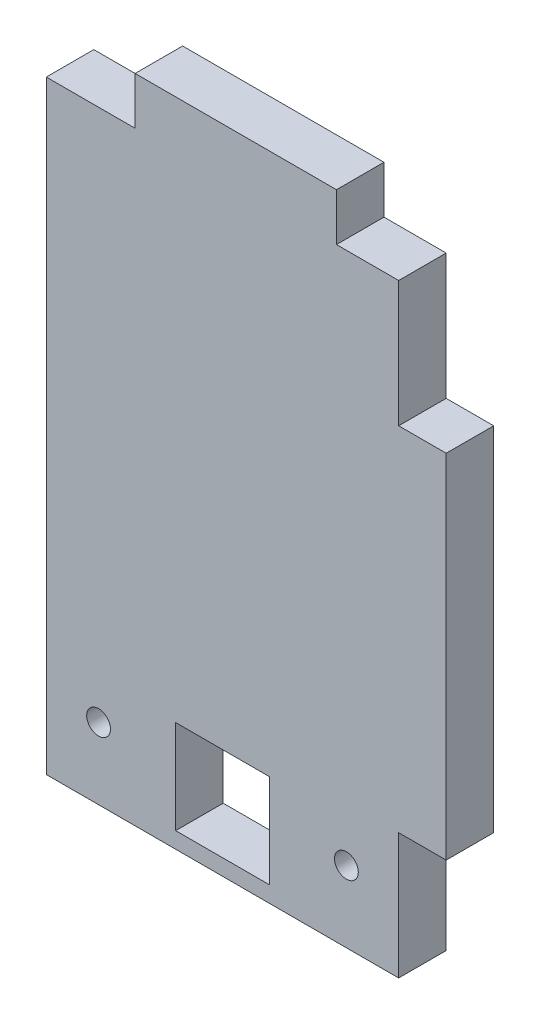
from build123d import *

# Parameters (mm, degrees)
SKETCH1_R           = 1.5
SKETCH1_W           = 11.811
SKETCH1_H           = 11.811
BOSS_EXTRUDE1_DEPTH = 5.9944


with BuildPart() as part:
    # Sketch1 → Boss-Extrude1 (new body)
    with BuildSketch(Plane.XY):
        Polygon((44.45, -60.325), (50.4444, -60.325), (50.4444, -15.875), (44.45, -15.875), (44.45, 0), (36.603489481, 0), (36.603489481, 5.9944), (11.203489481, 5.9944), (11.203489481, 0), (0, 0), (0, -76.2), (44.45, -76.2), align=None)
        with Locations(Location((6.595000018, -67.199999966, 0), (0, 0, 180))):
            Circle(SKETCH1_R, mode=Mode.SUBTRACT)
        with Locations(Location((37.854999982, -67.199999966, 0), (0, 0, 180))):
            Circle(SKETCH1_R, mode=Mode.SUBTRACT)
        with Locations((22.225, -68.2625)):
            Rectangle(SKETCH1_W, SKETCH1_H, mode=Mode.SUBTRACT)
    extrude(amount=BOSS_EXTRUDE1_DEPTH)


solid = part.part
